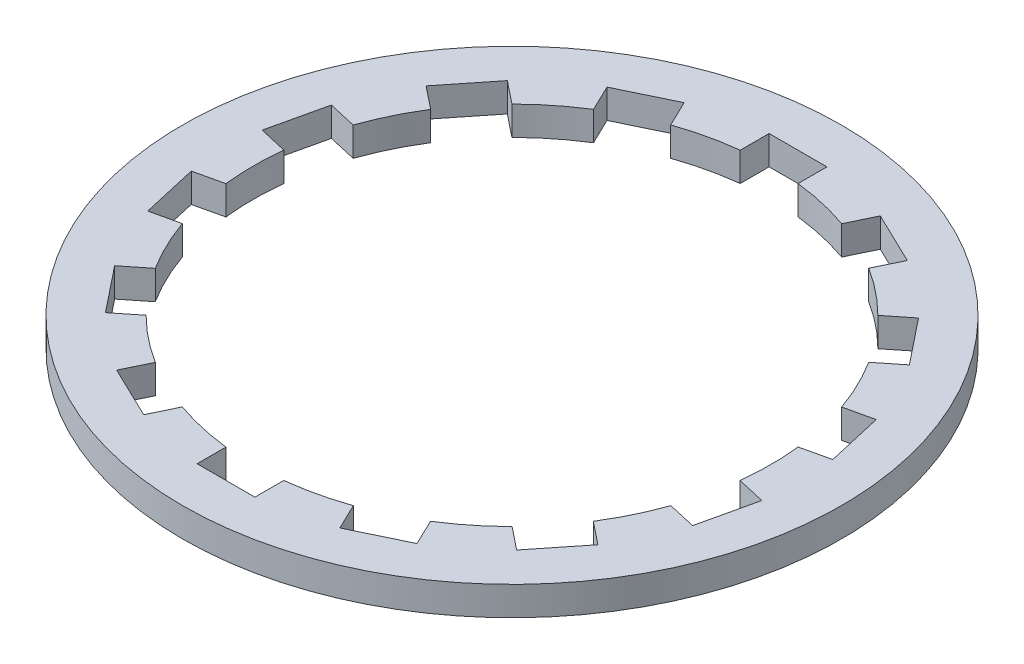
from build123d import *

# Parameters (mm, degrees)
SKETCH1_R           = 57
BOSS_EXTRUDE1_DEPTH = 2.5


with BuildPart() as part:
    # Sketch1 → Boss-Extrude1 (new, symmetric)
    with BuildSketch(Plane(origin=(0, 0, 0), x_dir=(1, 0, 0), z_dir=(0, 1, 0))):
        with Locations(Location((0, 0, 0), (0, 0, 270))):
            Circle(SKETCH1_R)
        with BuildLine():
            Line((14.789875777, 42.235317857), (16.959294472, 46.740162197))
            Line((16.959294472, 46.740162197), (25.968983151, 42.401324806))
            Line((25.968983151, 42.401324806), (23.799564456, 37.896480466))
            ThreePointArc((23.799564456, 37.896480466), (27.901168633, 34.98695884), (31.65043527, 31.635619912))
            Line((31.65043527, 31.635619912), (35.559592682, 34.753068922))
            Line((35.559592682, 34.753068922), (41.7944907, 26.934754097))
            Line((41.7944907, 26.934754097), (37.885333288, 23.817305088))
            ThreePointArc((37.885333288, 23.817305088), (40.318356839, 19.416297326), (42.24223789, 14.770099458))
            Line((42.24223789, 14.770099458), (47.116877451, 15.882704128))
            Line((47.116877451, 15.882704128), (49.342086791, 6.133425006))
            Line((49.342086791, 6.133425006), (44.46744723, 5.020820337))
            ThreePointArc((44.46744723, 5.020820337), (44.679305968, 2.514382276), (44.75, 0))
            ThreePointArc((44.75, 0), (44.679305968, -2.514382276), (44.46744723, -5.020820337))
            Line((44.46744723, -5.020820337), (49.342086791, -6.133425006))
            Line((49.342086791, -6.133425006), (47.116877451, -15.882704128))
            Line((47.116877451, -15.882704128), (42.24223789, -14.770099458))
            ThreePointArc((42.24223789, -14.770099458), (40.318356839, -19.416297326), (37.885333288, -23.817305088))
            Line((37.885333288, -23.817305088), (41.7944907, -26.934754097))
            Line((41.7944907, -26.934754097), (35.559592682, -34.753068922))
            Line((35.559592682, -34.753068922), (31.65043527, -31.635619912))
            ThreePointArc((31.65043527, -31.635619912), (27.901168633, -34.98695884), (23.799564456, -37.896480466))
            Line((23.799564456, -37.896480466), (25.968983151, -42.401324806))
            Line((25.968983151, -42.401324806), (16.959294472, -46.740162197))
            Line((16.959294472, -46.740162197), (14.789875777, -42.235317857))
            ThreePointArc((14.789875777, -42.235317857), (9.957811795, -43.62802407), (5, -44.469793118))
            Line((5, -44.469793118), (5, -49.469793118))
            Line((5, -49.469793118), (-5, -49.469793118))
            Line((-5, -49.469793118), (-5, -44.469793118))
            ThreePointArc((-5, -44.469793118), (-9.957811795, -43.62802407), (-14.789875777, -42.235317857))
            Line((-14.789875777, -42.235317857), (-16.959294472, -46.740162197))
            Line((-16.959294472, -46.740162197), (-25.968983151, -42.401324806))
            Line((-25.968983151, -42.401324806), (-23.799564456, -37.896480466))
            ThreePointArc((-23.799564456, -37.896480466), (-27.901168633, -34.98695884), (-31.65043527, -31.635619912))
            Line((-31.65043527, -31.635619912), (-35.559592682, -34.753068922))
            Line((-35.559592682, -34.753068922), (-41.7944907, -26.934754097))
            Line((-41.7944907, -26.934754097), (-37.885333288, -23.817305088))
            ThreePointArc((-37.885333288, -23.817305088), (-40.318356839, -19.416297326), (-42.24223789, -14.770099458))
            Line((-42.24223789, -14.770099458), (-47.116877451, -15.882704128))
            Line((-47.116877451, -15.882704128), (-49.342086791, -6.133425006))
            Line((-49.342086791, -6.133425006), (-44.46744723, -5.020820337))
            ThreePointArc((-44.46744723, -5.020820337), (-44.75, 0), (-44.46744723, 5.020820337))
            Line((-44.46744723, 5.020820337), (-49.342086791, 6.133425006))
            Line((-49.342086791, 6.133425006), (-47.116877451, 15.882704128))
            Line((-47.116877451, 15.882704128), (-42.24223789, 14.770099458))
            ThreePointArc((-42.24223789, 14.770099458), (-40.318356839, 19.416297326), (-37.885333288, 23.817305088))
            Line((-37.885333288, 23.817305088), (-41.7944907, 26.934754097))
            Line((-41.7944907, 26.934754097), (-35.559592682, 34.753068922))
            Line((-35.559592682, 34.753068922), (-31.65043527, 31.635619912))
            ThreePointArc((-31.65043527, 31.635619912), (-27.901168633, 34.98695884), (-23.799564456, 37.896480466))
            Line((-23.799564456, 37.896480466), (-25.968983151, 42.401324806))
            Line((-25.968983151, 42.401324806), (-16.959294472, 46.740162197))
            Line((-16.959294472, 46.740162197), (-14.789875777, 42.235317857))
            ThreePointArc((-14.789875777, 42.235317857), (-9.957811795, 43.62802407), (-5, 44.469793118))
            Line((-5, 44.469793118), (-5, 49.469793118))
            Line((-5, 49.469793118), (5, 49.469793118))
            Line((5, 49.469793118), (5, 44.469793118))
            ThreePointArc((5, 44.469793118), (9.957811795, 43.62802407), (14.789875777, 42.235317857))
        make_face(mode=Mode.SUBTRACT)
    extrude(amount=BOSS_EXTRUDE1_DEPTH, both=True)


solid = part.part
